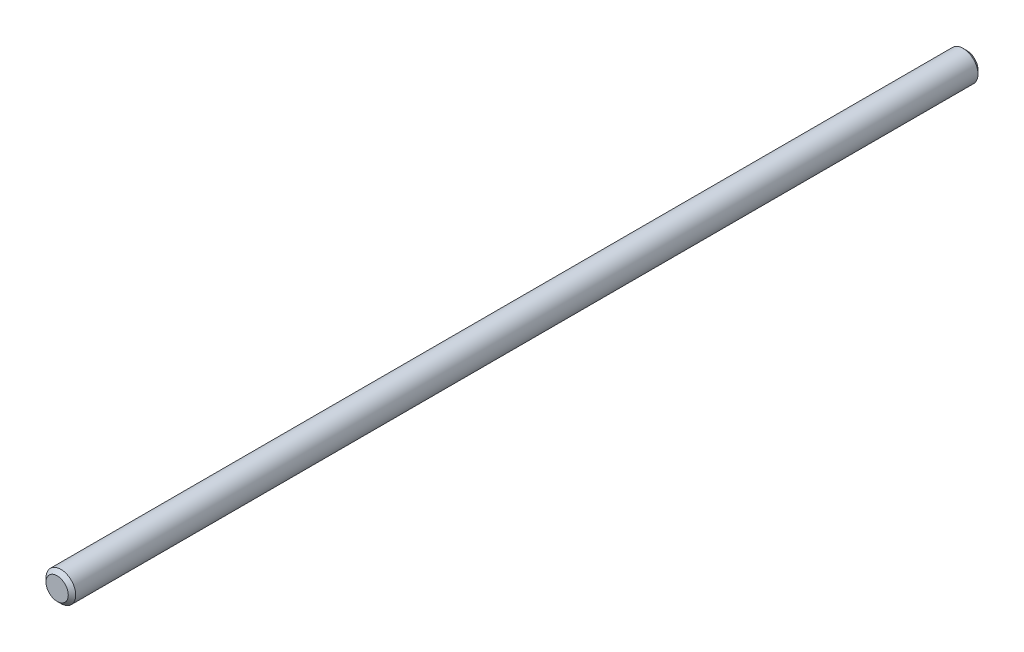
from build123d import *

# Parameters (mm, degrees)
SKICA1_R                = 4
P_IDAT_VYSUNUT_M1_DEPTH = 245
ZKOSEN_1_SIZE           = 1


with BuildPart() as part:
    # Skica1 → Přidat vysunutím1 (new body)
    with BuildSketch(Plane.XY):
        Circle(SKICA1_R)
    extrude(amount=P_IDAT_VYSUNUT_M1_DEPTH)

    # Zkosení1
    zkosen_1_edges = [part.edges().sort_by_distance(p)[0] for p in [
        (-4, 0, 0),
        (-4, 0, 245),
    ]]
    chamfer(zkosen_1_edges, length=ZKOSEN_1_SIZE)


solid = part.part
